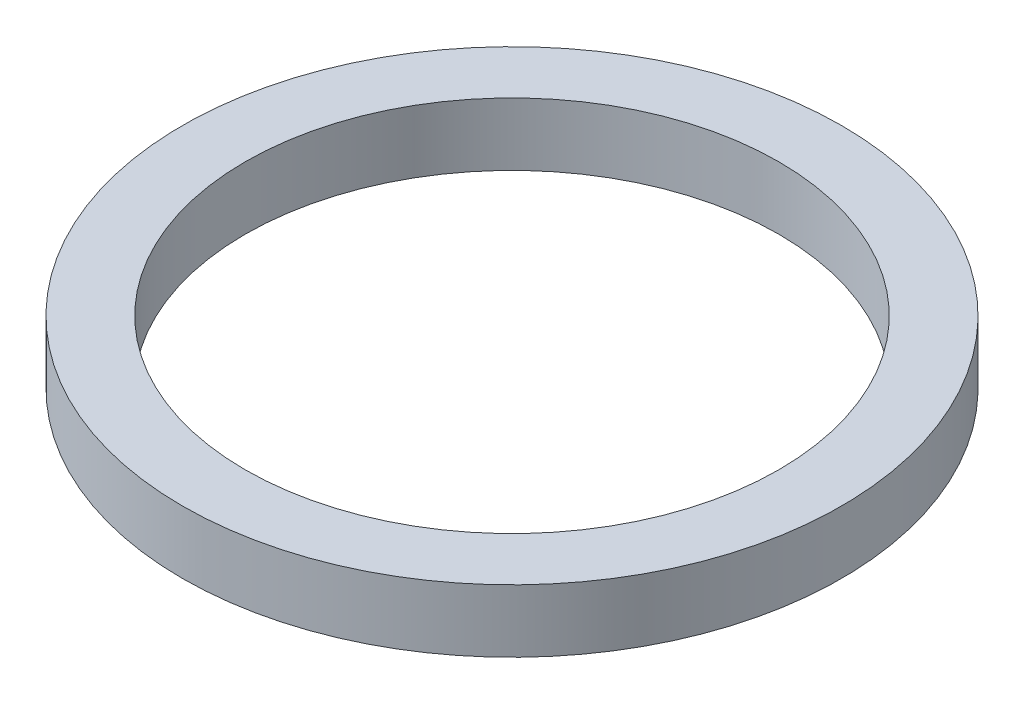
from build123d import *

# Parameters (mm, degrees)
SKETCH1_R           = 10.5
SKETCH1_R_2         = 8.5
BOSS_EXTRUDE1_DEPTH = 2


with BuildPart() as part:
    # Sketch1 → Boss-Extrude1 (new body)
    with BuildSketch(Plane(origin=(0, 0, 0), x_dir=(1, 0, 0), z_dir=(0, 1, 0))):
        with Locations(Location((0, 0, 0), (0, 0, 270))):
            Circle(SKETCH1_R)
        with Locations(Location((0, 0, 0), (0, 0, 270))):
            Circle(SKETCH1_R_2, mode=Mode.SUBTRACT)
    extrude(amount=BOSS_EXTRUDE1_DEPTH)


solid = part.part
